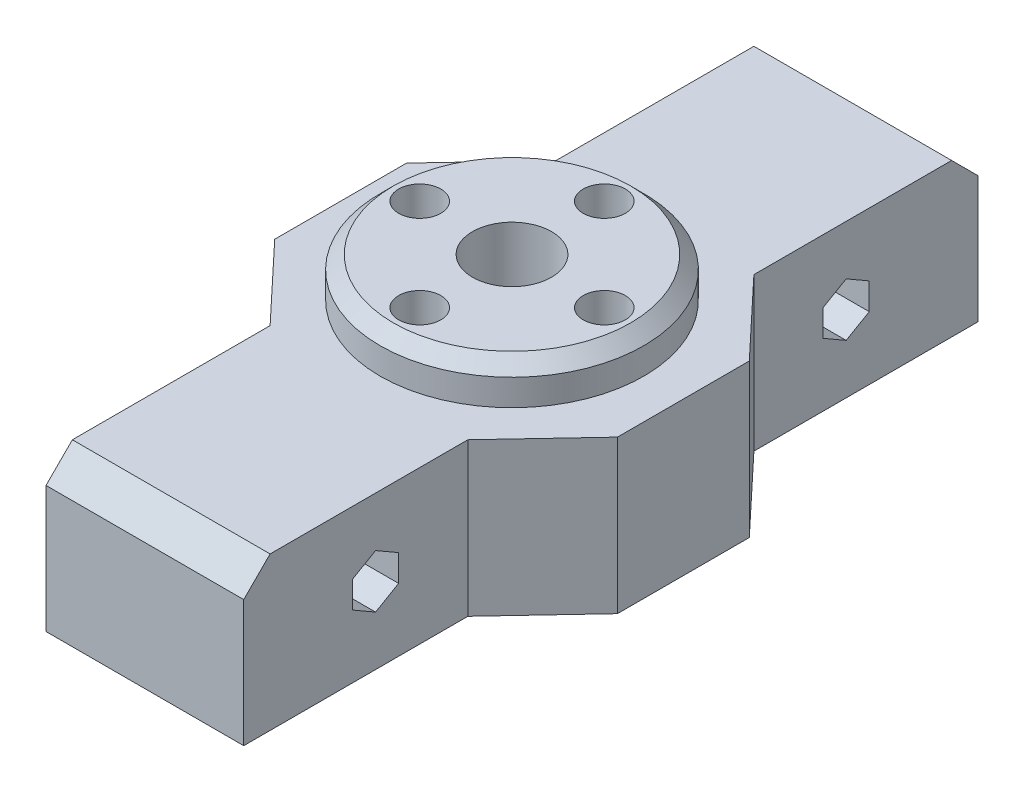
from build123d import *

# Parameters (mm, degrees)
BOSS_EXTRU_1_DEPTH                                = 11.6
ESQUISSE2_R                                       = 10
BOSS_EXTRU_2_DEPTH                                = 3
ENL_V_MAT_EXTRU_1_DEPTH                           = 35.026203138
ENL_V_MAT_EXTRU_1_DEPTH_BACK                      = 35.026203138
ESQUISSE3_R                                       = 1.6
ESQUISSE3_R_2                                     = 3
CHAMBRAGE_POUR_VIS_SIX_PANS_CREUX_M41_D           = 3.2
CHAMBRAGE_POUR_VIS_SIX_PANS_CREUX_M41_CBORE_D     = 6
CHAMBRAGE_POUR_VIS_SIX_PANS_CREUX_M41_CBORE_DEPTH = 8
ENL_V_MAT_EXTRU_2_DEPTH                           = 38.537081666
ENL_V_MAT_EXTRU_2_DEPTH_BACK                      = 38.537081666
CHANFREIN1_SIZE                                   = 2
CHANFREIN2_SIZE                                   = 1


with BuildPart() as part:
    # Esquisse1 → Boss.-Extru.1 (new body)
    with BuildSketch(Plane(origin=(0, 0, 0), x_dir=(1, 0, 0), z_dir=(0, 1, 0))):
        Polygon((7.5, 27.85), (-7.5, 27.85), (-7.5, 10.85), (-13, 5), (-13, -5), (-7.5, -10.85), (-7.5, -27.85), (7.5, -27.85), (7.5, -10.85), (13, -5), (13, 5), (7.5, 10.85), align=None)
    extrude(amount=BOSS_EXTRU_1_DEPTH)

    # Esquisse2 → Boss.-Extru.2 (add)
    with BuildSketch(Plane(origin=(0, 11.6, 0), x_dir=(1, 0, 0), z_dir=(0, 1, 0))):
        with Locations(Location((0, 0, 0), (0, 0, 270))):
            Circle(ESQUISSE2_R)
    extrude(amount=BOSS_EXTRU_2_DEPTH)

    # Esquisse3 → Enlèv. mat.-Extru.1 (cut, two sides: drawn at the far end of the back side and taken through both)
    with BuildSketch(Plane.XZ.offset(-ENL_V_MAT_EXTRU_1_DEPTH_BACK)):
        with Locations(Location((0, 7, 0), (0, 0, 270))):
            Circle(ESQUISSE3_R)
        with Locations(Location((7, 0, 0), (0, 0, 270))):
            Circle(ESQUISSE3_R)
        with Locations(Location((0, -7, 0), (0, 0, 270))):
            Circle(ESQUISSE3_R)
        with Locations(Location((-7, 0, 0), (0, 0, 270))):
            Circle(ESQUISSE3_R)
        with Locations(Location((0, 0, 0), (0, 0, 270))):
            Circle(ESQUISSE3_R_2)
    extrude(amount=ENL_V_MAT_EXTRU_1_DEPTH + ENL_V_MAT_EXTRU_1_DEPTH_BACK, mode=Mode.SUBTRACT)

    # Chambrage pour vis à six pans creux M41 (through all)
    with Locations(Plane(origin=(0, 0, 0), x_dir=(-1, 0, 0), z_dir=(0, -1, 0))):
        with Locations((0, 0), (0, 7), (7, 0), (0, -7), (-7, 0)):
            CounterBoreHole(CHAMBRAGE_POUR_VIS_SIX_PANS_CREUX_M41_D / 2, CHAMBRAGE_POUR_VIS_SIX_PANS_CREUX_M41_CBORE_D / 2, CHAMBRAGE_POUR_VIS_SIX_PANS_CREUX_M41_CBORE_DEPTH)

    # Esquisse6 → Enlèv. mat.-Extru.2 (cut, two sides: drawn at the far end of the back side and taken through both)
    with BuildSketch(Plane.ZY.offset(7.5).offset(-ENL_V_MAT_EXTRU_2_DEPTH_BACK)):
        Polygon((16.1, 6.810362971), (17.85, 7.820725942), (19.6, 6.810362971), (19.6, 4.789637029), (17.85, 3.779274058), (16.1, 4.789637029), align=None)
        Polygon((-17.85, 7.820725942), (-19.6, 6.810362971), (-19.6, 4.789637029), (-17.85, 3.779274058), (-16.1, 4.789637029), (-16.1, 6.810362971), align=None)
    extrude(amount=ENL_V_MAT_EXTRU_2_DEPTH + ENL_V_MAT_EXTRU_2_DEPTH_BACK, mode=Mode.SUBTRACT)

    # Chanfrein1
    chanfrein1_edges = [part.edges().sort_by_distance(p)[0] for p in [
        (0, 11.6, 27.85),
        (0, 11.6, -27.85),
    ]]
    chamfer(chanfrein1_edges, length=CHANFREIN1_SIZE)

    # Chanfrein2
    chanfrein2_edges = [part.edges().sort_by_distance(p)[0] for p in [
        (0, 14.6, -10),
    ]]
    chamfer(chanfrein2_edges, length=CHANFREIN2_SIZE)


solid = part.part
